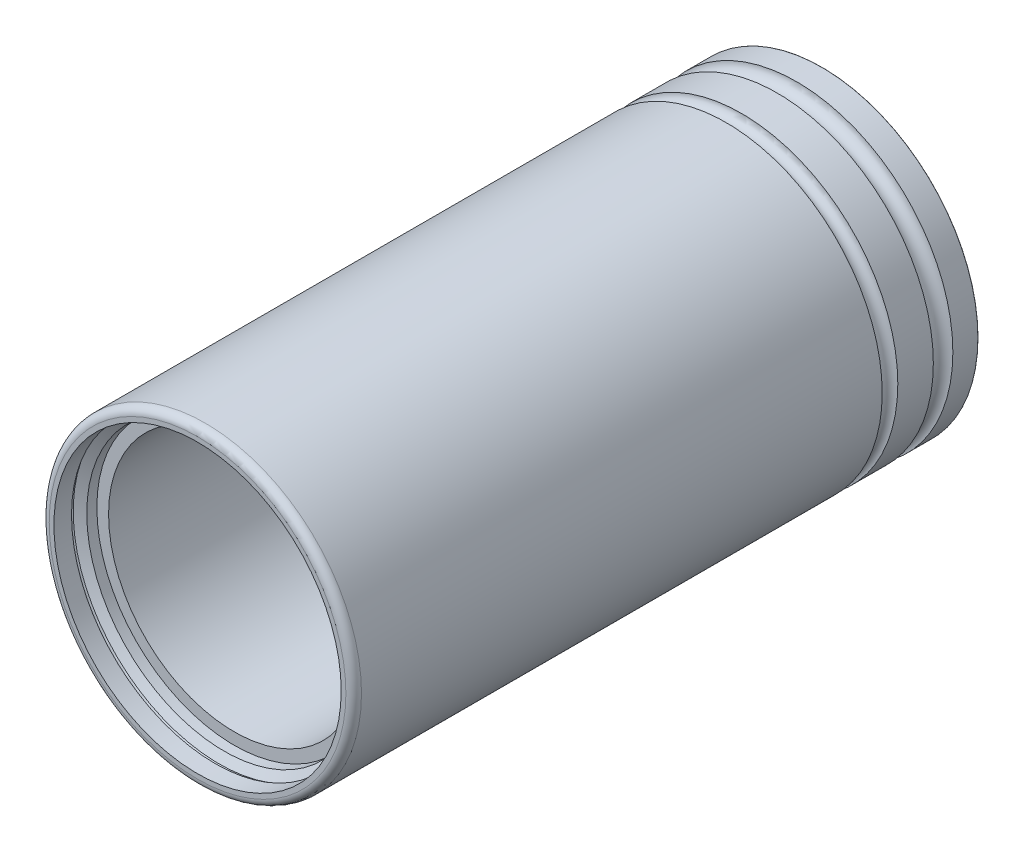
from build123d import *

# Parameters (mm, degrees)
SKETCH_1_R          = 20
EXTRUDE_1_DEPTH     = 80
FILLET_2_R          = 1
SKETCH_6_R          = 18.4
CUT_EXTRUDE_1_DEPTH = 2.6
FILLET_3_R          = 0.05
SKETCH_8_R          = 1.25
SKETCH_8_R_2        = 1
FILLET_12_R         = 0.4
FILLET_13_R         = 0.2
FILLET_14_R         = 0.2
FILLET_15_R         = 0.4
FILLET_16_R         = 0.2


with BuildPart() as part:
    # Эскиз1 → Бобышка-Вытянуть1 (new body)
    with BuildSketch(Plane.XY):
        Circle(SKETCH_1_R)
    extrude(amount=-EXTRUDE_1_DEPTH)

    # Эскиз4 → Вырез-Повернуть1 (revolve, cut)
    with BuildSketch(Plane(origin=(0, 0, 0), x_dir=(0, 0, -1), z_dir=(1, 0, 0)), mode=Mode.PRIVATE) as cut_revolve_1_sk:
        with BuildLine():
            Line((0, 0), (0, 17.6))
            Line((0, 17.6), (4.7, 17.6))
            Line((4.7, 17.6), (4.7, 16.1))
            Line((4.7, 16.1), (27, 16.1))
            Line((27, 16.1), (27, 17.1))
            Line((27, 17.1), (28.4, 17.1))
            Line((28.4, 17.1), (28.919615242, 16.2))
            Line((28.919615242, 16.2), (29.8, 16.2))
            Line((29.8, 16.2), (29.8, 17.7))
            Line((29.8, 17.7), (33.8, 17.7))
            Line((33.8, 17.7), (33.8, 16.2))
            Line((33.8, 16.2), (34.8, 16.2))
            Line((34.8, 16.2), (34.8, 17.9))
            Line((34.8, 17.9), (38, 17.9))
            Line((38, 17.9), (38, 16.2))
            Line((38, 16.2), (39, 16.2))
            Line((39, 16.2), (39, 17.7))
            Line((39, 17.7), (47.8, 17.7))
            Line((47.8, 17.7), (47.8, 16.2))
            Line((47.8, 16.2), (48.8, 16.2))
            Line((48.8, 16.2), (48.8, 17.9))
            Line((48.8, 17.9), (52, 17.9))
            Line((52, 17.9), (52, 16.2))
            Line((52, 16.2), (55, 16.2))
            Line((55, 16.2), (55, 6))
            Line((55, 6), (57, 6))
            Line((57, 6), (57, 9.5))
            Line((57, 9.5), (60.8, 9.5))
            ThreePointArc((60.8, 9.5), (61.4, 10.1), (62, 9.5))
            Line((62, 9.5), (63.5, 9.5))
            Line((63.5, 9.5), (63.5, 10.75))
            Line((63.5, 10.75), (75, 10.75))
            Line((75, 10.75), (75, 12.4))
            Line((75, 12.4), (78, 12.4))
            Line((78, 12.4), (78, 10.75))
            Line((78, 10.75), (80, 10.75))
            Line((80, 10.75), (80, 0))
            Line((80, 0), (0, 0))
        make_face()
    revolve(cut_revolve_1_sk.sketch.rotate(Axis((0, 0, -80), (0, 0, 1)), 90), axis=Axis((0, 0, -80), (0, 0, 1)), mode=Mode.SUBTRACT)

    # Эскиз5 → Вырез-Повернуть2 (revolve, cut)
    with BuildSketch(Plane(origin=(0, 0, 0), x_dir=(0, 0, -1), z_dir=(1, 0, 0)), mode=Mode.PRIVATE) as cut_revolve_2_sk:
        Polygon((3.408290377, 17.6), (1.791709623, 17.6), (2.6, 19), align=None)
    revolve(cut_revolve_2_sk.sketch.rotate(Axis((0, 0, 0), (0, 0, -1)), 270), axis=Axis((0, 0, 0), (0, 0, -1)), mode=Mode.SUBTRACT)

    # Скругление2
    fillet_2_edges = [part.edges().sort_by_distance(p)[0] for p in [
        (-20, 0, 0),
    ]]
    fillet(fillet_2_edges, radius=FILLET_2_R)

    # Эскиз6 → Вырез-Вытянуть1 (cut)
    with BuildSketch(Plane.XY):
        Circle(SKETCH_6_R)
    extrude(amount=-CUT_EXTRUDE_1_DEPTH, mode=Mode.SUBTRACT)

    # Скругление3
    fillet_3_edges = [part.edges().sort_by_distance(p)[0] for p in [
        (10.75, 0, -80),
        (-20, 0, -80),
        (6, 0, -57),
    ]]
    fillet(fillet_3_edges, radius=FILLET_3_R)

    # Эскиз7 → Повернуть1 (revolve)
    with BuildSketch(Plane(origin=(0, 0, 0), x_dir=(1, 0, 0), z_dir=(0, 1, 0))):
        with BuildLine():
            Line((-14.5, 80), (-15.955857244, 80))
            Line((-15.955857244, 80), (-15.955857244, 80.896736064))
            ThreePointArc((-15.955857244, 80.896736064), (-15.662964025, 81.603842845), (-14.955857244, 81.896736064))
            Line((-14.955857244, 81.896736064), (-14.054213222, 81.896736064))
            ThreePointArc((-14.054213222, 81.896736064), (-13.347106441, 81.603842845), (-13.054213222, 80.896736064))
            Line((-13.054213222, 80.896736064), (-13.054213222, 80))
            Line((-13.054213222, 80), (-14.5, 80))
        make_face()
    revolve(axis=Axis((0, 0, -88.958875933), (0, 0, 1)))

    # Эскиз8 → Вырез-Повернуть3 (revolve, cut)
    with BuildSketch(Plane(origin=(0, 0, 0), x_dir=(0, 0, -1), z_dir=(1, 0, 0)), mode=Mode.PRIVATE) as cut_revolve_3_sk:
        with Locations((75.5, 20)):
            Circle(SKETCH_8_R)
        with Locations((68.7, 20)):
            Circle(SKETCH_8_R_2)
    revolve(cut_revolve_3_sk.sketch.rotate(Axis((0, 0, 0), (0, 0, -1)), 90), axis=Axis((0, 0, 0), (0, 0, -1)), mode=Mode.SUBTRACT)

    # Скругление12
    fillet_12_edges = [part.edges().sort_by_distance(p)[0] for p in [
        (17.9, 0, -34.8),
        (17.9, 0, -38),
        (17.9, 0, -48.8),
        (17.9, 0, -52),
    ]]
    fillet(fillet_12_edges, radius=FILLET_12_R)

    # Скругление13
    fillet_13_edges = [part.edges().sort_by_distance(p)[0] for p in [
        (16.2, 0, -34.8),
        (16.2, 0, -38),
        (16.2, 0, -48.8),
        (16.2, 0, -52),
    ]]
    fillet(fillet_13_edges, radius=FILLET_13_R)

    # Скругление14
    fillet_14_edges = [part.edges().sort_by_distance(p)[0] for p in [
        (10.75, 0, -78),
        (10.75, 0, -75),
    ]]
    fillet(fillet_14_edges, radius=FILLET_14_R)

    # Скругление15
    fillet_15_edges = [part.edges().sort_by_distance(p)[0] for p in [
        (12.4, 0, -75),
        (12.4, 0, -78),
    ]]
    fillet(fillet_15_edges, radius=FILLET_15_R)

    # Скругление16
    fillet_16_edges = [part.edges().sort_by_distance(p)[0] for p in [
        (19, 0, -2.6),
    ]]
    fillet(fillet_16_edges, radius=FILLET_16_R)


solid = part.part
